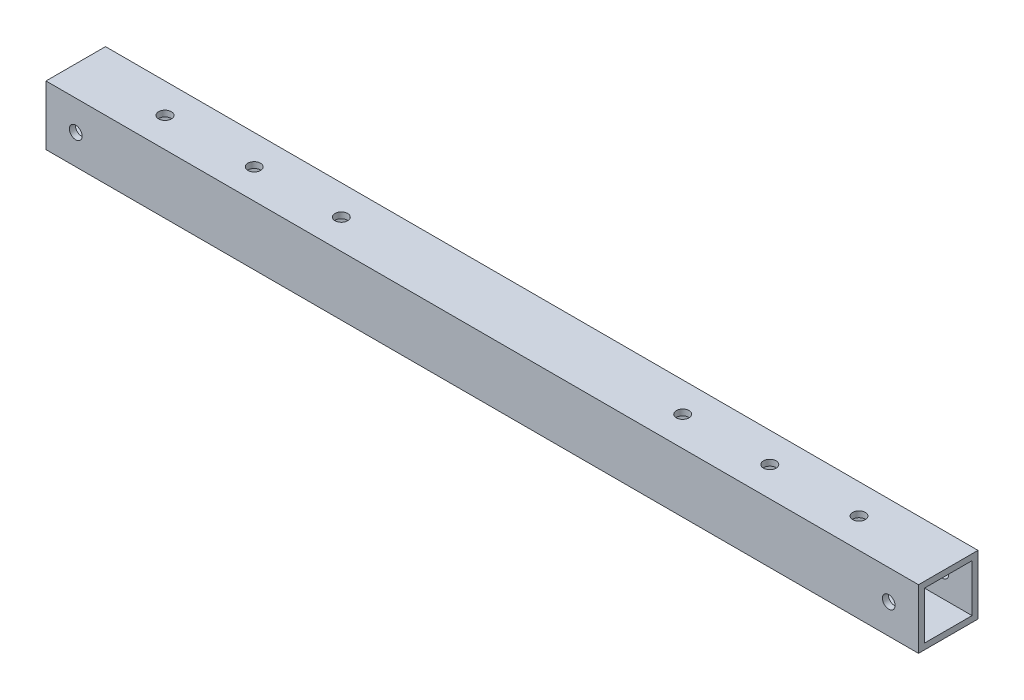
from build123d import *

# Parameters (mm, degrees)
SKETCH_1_W          = 15
SKETCH_1_H          = 15
SKETCH_1_W_2        = 12
SKETCH_1_H_2        = 12
EXTRUDE_1_DEPTH     = 220
SKETCH_2_R          = 1.6
CUT_EXTRUDE_1_DEPTH = 221.638278637
SKETCH_3_R          = 1.6
CUT_EXTRUDE_2_DEPTH = 221.638278637


with BuildPart() as part:
    # ｽｹｯﾁ1 → ﾎﾞｽ - 押し出し1 (new body)
    with BuildSketch(Plane(origin=(0, 0, 0), x_dir=(0, 0, -1), z_dir=(1, 0, 0))):
        Rectangle(SKETCH_1_W, SKETCH_1_H)
        Rectangle(SKETCH_1_W_2, SKETCH_1_H_2, mode=Mode.SUBTRACT)
    extrude(amount=EXTRUDE_1_DEPTH)

    # ｽｹｯﾁ2 → ｶｯﾄ - 押し出し1 (cut, through all)
    with BuildSketch(Plane(origin=(0, 7.5, 0), x_dir=(1, 0, 0), z_dir=(0, 1, 0))):
        with Locations(Location((66.961524227, 0, 0), (0, 0, 270))):
            Circle(SKETCH_2_R)
        with Locations(Location((45, 0, 0), (0, 0, 270))):
            Circle(SKETCH_2_R)
        with Locations(Location((175, 0, 0), (0, 0, 270))):
            Circle(SKETCH_2_R)
        with Locations(Location((153.038475773, 0, 0), (0, 0, 270))):
            Circle(SKETCH_2_R)
        with Locations(Location((22.5, 0, 0), (0, 0, 270))):
            Circle(SKETCH_2_R)
        with Locations(Location((197.5, 0, 0), (0, 0, 270))):
            Circle(SKETCH_2_R)
    extrude(amount=-CUT_EXTRUDE_1_DEPTH, mode=Mode.SUBTRACT)

    # ｽｹｯﾁ3 → ｶｯﾄ - 押し出し2 (cut, through all)
    with BuildSketch(Plane.XY.offset(7.5)):
        with Locations((7.5, 0)):
            Circle(SKETCH_3_R)
        with Locations((212.5, 0)):
            Circle(SKETCH_3_R)
    extrude(amount=-CUT_EXTRUDE_2_DEPTH, mode=Mode.SUBTRACT)


solid = part.part
